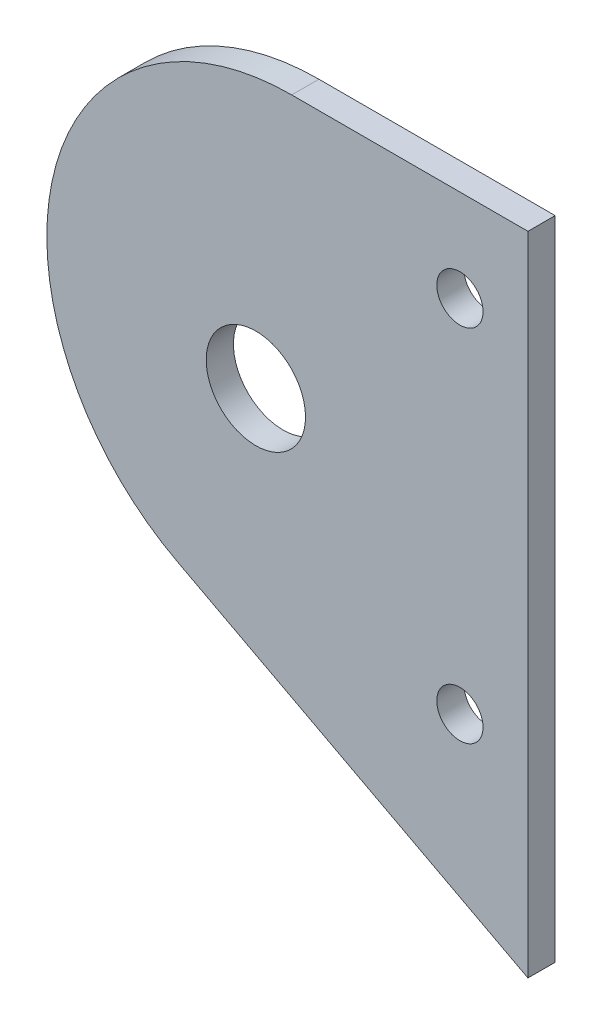
from build123d import *

# Parameters (mm, degrees)
ESQUISSE1_R                  = 3.65
BOSS_EXTRU_1_DEPTH           = 2
CONG_1_R                     = 18
CONG_2_R                     = 20
ENL_V_MAT_EXTRU_2_DEPTH      = 195.530962239
ENL_V_MAT_EXTRU_2_DEPTH_BACK = 10
ESQUISSE2_W                  = 356.718168982
ESQUISSE2_H                  = 96.805953854
D_GAGEMENT_M31_D             = 3.4


with BuildPart() as part:
    # Esquisse1 → Boss.-Extru.1 (new body)
    with BuildSketch(Plane.XY):
        Polygon((-244.958991582, 40), (-110, 40), (110, 40), (244.958991582, 40), (112.479495791, -30), (-112.479495791, -30), align=None)
        with Locations((-175, 20)):
            Circle(ESQUISSE1_R, mode=Mode.SUBTRACT)
        with Locations((-110, -20)):
            Circle(ESQUISSE1_R, mode=Mode.SUBTRACT)
        with Locations((110, -20)):
            Circle(ESQUISSE1_R, mode=Mode.SUBTRACT)
        with Locations((175, 20)):
            Circle(ESQUISSE1_R, mode=Mode.SUBTRACT)
        with Locations((0, -20)):
            Circle(ESQUISSE1_R, mode=Mode.SUBTRACT)
        with Locations((-58.333333333, 20)):
            Circle(ESQUISSE1_R, mode=Mode.SUBTRACT)
        with Locations((58.333333333, 20)):
            Circle(ESQUISSE1_R, mode=Mode.SUBTRACT)
    extrude(amount=BOSS_EXTRU_1_DEPTH)

    # Congé1
    cong_1_edges = [part.edges().sort_by_distance(p)[0] for p in [
        (-244.958991582, 40, 1),
        (244.958991582, 40, 1),
    ]]
    fillet(cong_1_edges, radius=CONG_1_R)

    # Congé2
    cong_2_edges = [part.edges().sort_by_distance(p)[0] for p in [
        (112.479495791, -30, 1),
        (-112.479495791, -30, 1),
    ]]
    fillet(cong_2_edges, radius=CONG_2_R)

    # Esquisse2 → Enlèv. mat.-Extru.2 (cut, two sides: drawn at the far end of the back side and taken through both)
    with BuildSketch(Plane.XY.offset(-ENL_V_MAT_EXTRU_2_DEPTH_BACK)):
        with Locations((23.359084491, 12.745190259)):
            Rectangle(ESQUISSE2_W, ESQUISSE2_H)
    extrude(amount=ENL_V_MAT_EXTRU_2_DEPTH + ENL_V_MAT_EXTRU_2_DEPTH_BACK, mode=Mode.SUBTRACT)

    # Dégagement M31 (through all)
    with Locations(Plane(origin=(0, 0, 0), x_dir=(-1, 0, 0), z_dir=(0, 0, -1))):
        with Locations((160, 33.228756555), (160, 6.771243445)):
            Hole(D_GAGEMENT_M31_D / 2)


solid = part.part
